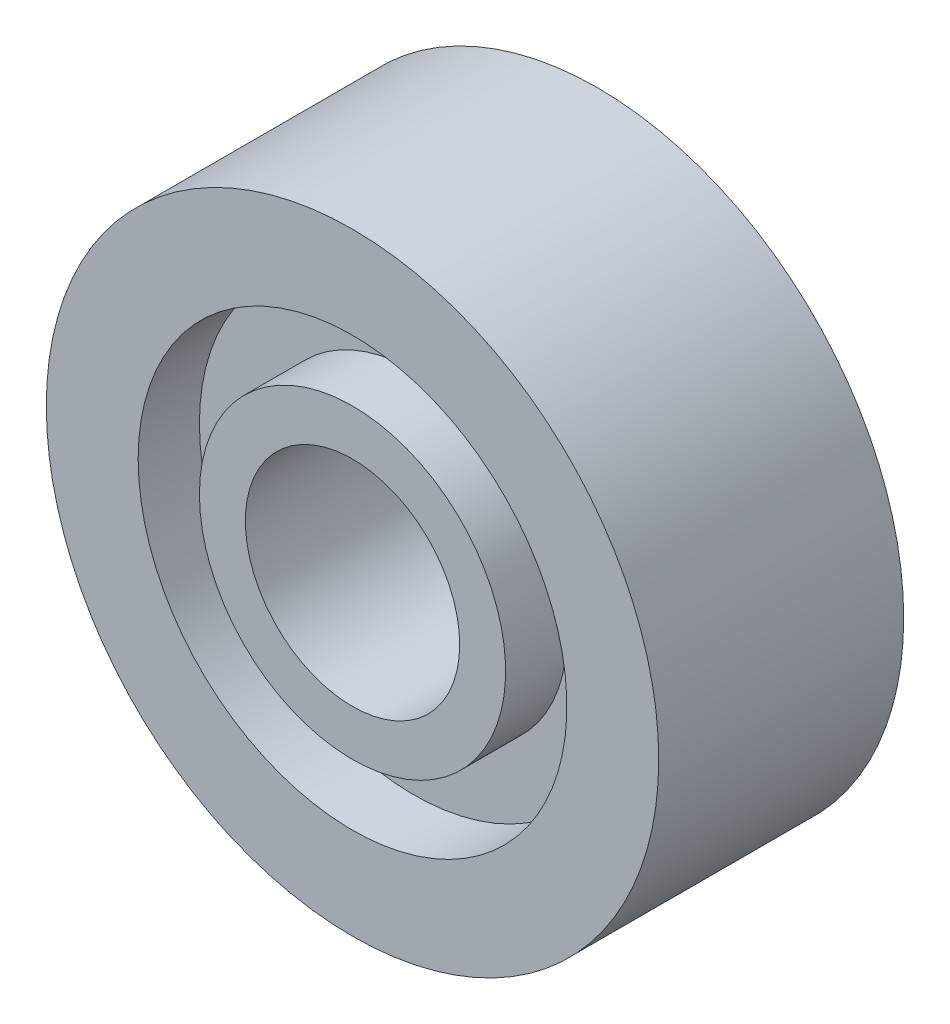
from build123d import *

# Parameters (mm, degrees)
SKETCH_1_R          = 5
SKETCH_1_R_2        = 1.75
EXTRUDE_1_DEPTH     = 4
SKETCH_2_R          = 3.5
SKETCH_2_R_2        = 2.5
CUT_EXTRUDE_1_DEPTH = 1


with BuildPart() as part:
    # Эскиз1 → Бобышка-Вытянуть1 (new body)
    with BuildSketch(Plane.XY):
        Circle(SKETCH_1_R)
        Circle(SKETCH_1_R_2, mode=Mode.SUBTRACT)
    extrude(amount=EXTRUDE_1_DEPTH)

    # Эскиз2 → Вырез-Вытянуть1 (cut)
    with BuildSketch(Plane(origin=(0, 0, 0), x_dir=(-1, 0, 0), z_dir=(0, 0, -1))):
        Circle(SKETCH_2_R)
        Circle(SKETCH_2_R_2, mode=Mode.SUBTRACT)
    cut_extrude_1 = extrude(amount=-CUT_EXTRUDE_1_DEPTH, mode=Mode.SUBTRACT)

    # Зеркальное отражение1: Вырез-Вытянуть1 across plane
    add(cut_extrude_1.mirror(Plane(origin=(0, 0, 2), x_dir=(1, 0, 0), z_dir=(0, 0, -1))), mode=Mode.SUBTRACT)


solid = part.part
